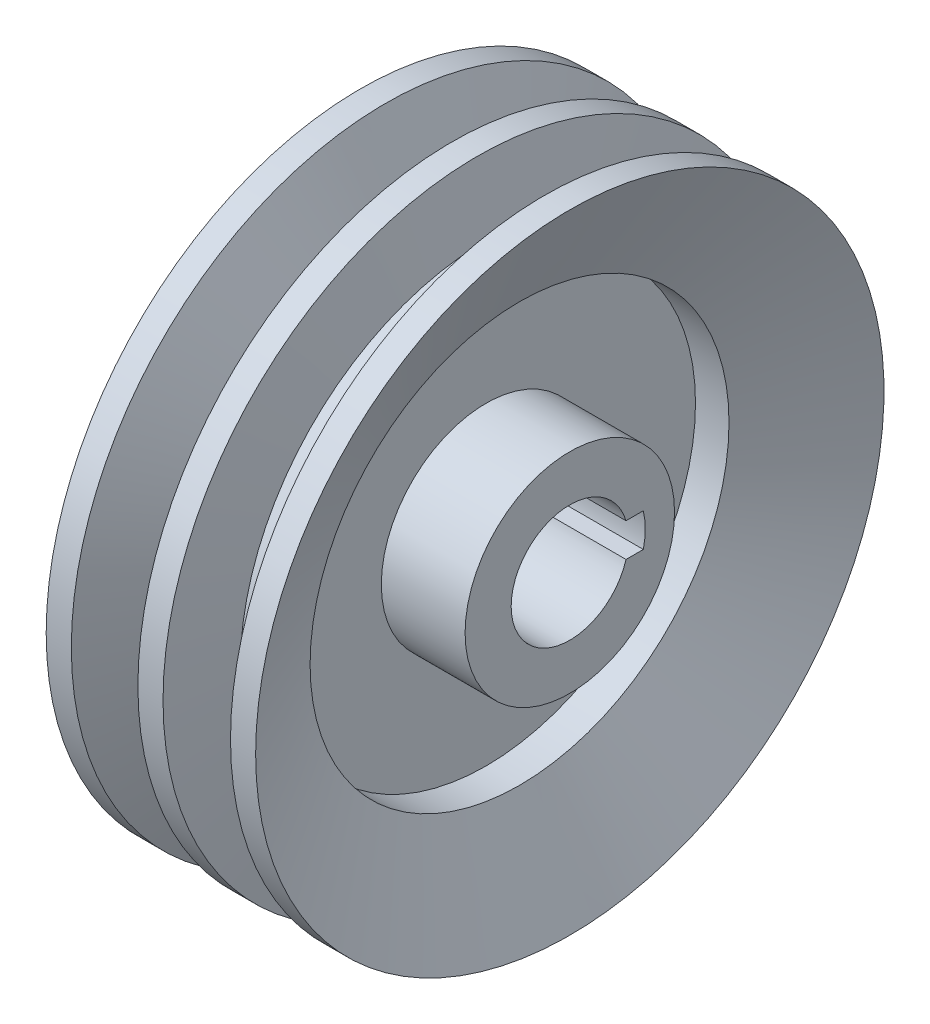
from build123d import *

# Parameters (mm, degrees)
CORTAR_EXTRUIR2_REACH = 3319.132


with BuildPart() as part:
    # Croquis3 → Revolución1 (revolve)
    with BuildSketch(Plane.XY, mode=Mode.PRIVATE) as revoluci_n1_sk:
        Polygon((-127, 139.7), (-127, 774.7), (-330.2, 774.7), (-635, 1409.7), (-482.6, 1409.7), (-287.528, 1003.3), (-135.128, 1003.3), (-78.878549621, 1409.7), (73.521450379, 1409.7), (135.128, 1003.3), (287.528, 1003.3), (482.6, 1409.7), (635, 1409.7), (330.2, 774.7), (127, 774.7), (127, 139.7), (635, 139.7), (635, -139.7), (-635, -139.7), (-635, 139.7), align=None)
    revolve(revoluci_n1_sk.sketch.rotate(Axis((-757.808630679, -495.3, 0), (1, 0, 0)), 90), axis=Axis((-757.808630679, -495.3, 0), (1, 0, 0)))

    # Croquis4 → Cortar-Extruir2 (cut, up to next)
    with BuildSketch(Plane(origin=(635, 0, 0), x_dir=(0, 0, -1), z_dir=(1, 0, 0)), mode=Mode.PRIVATE) as cortar_extruir2_sk1:
        with BuildLine():
            Line((340.776759771, -393.7), (445.76819088, -393.7))
            ThreePointArc((445.76819088, -393.7), (457.2, -495.3), (445.76819088, -596.9))
            Line((445.76819088, -596.9), (340.776759771, -596.9))
            ThreePointArc((340.776759771, -596.9), (355.6, -495.3), (340.776759771, -393.7))
        make_face()
    cortar_extruir2_tool1 = extrude(cortar_extruir2_sk1.sketch, amount=-CORTAR_EXTRUIR2_REACH, mode=Mode.PRIVATE) & part.part
    add(cortar_extruir2_tool1.solids().sort_by_distance((635, -495.3, -402.016611))[0], mode=Mode.SUBTRACT)


solid = part.part
